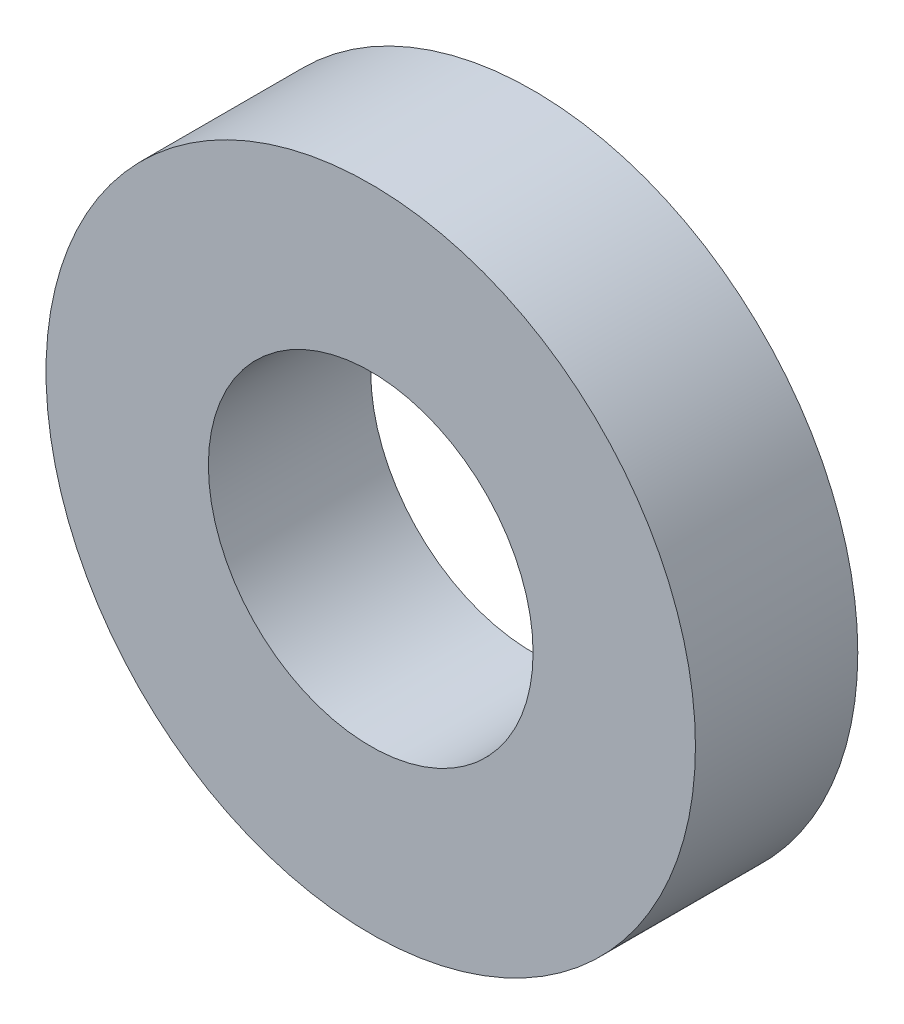
from build123d import *

# Parameters (mm, degrees)
SKETCH_1_R      = 30
SKETCH_1_R_2    = 15
EXTRUDE_1_DEPTH = 15


with BuildPart() as part:
    # 草图1 → 凸台-拉伸1 (new body)
    with BuildSketch(Plane.XY):
        Circle(SKETCH_1_R)
        Circle(SKETCH_1_R_2, mode=Mode.SUBTRACT)
    extrude(amount=EXTRUDE_1_DEPTH)


solid = part.part
